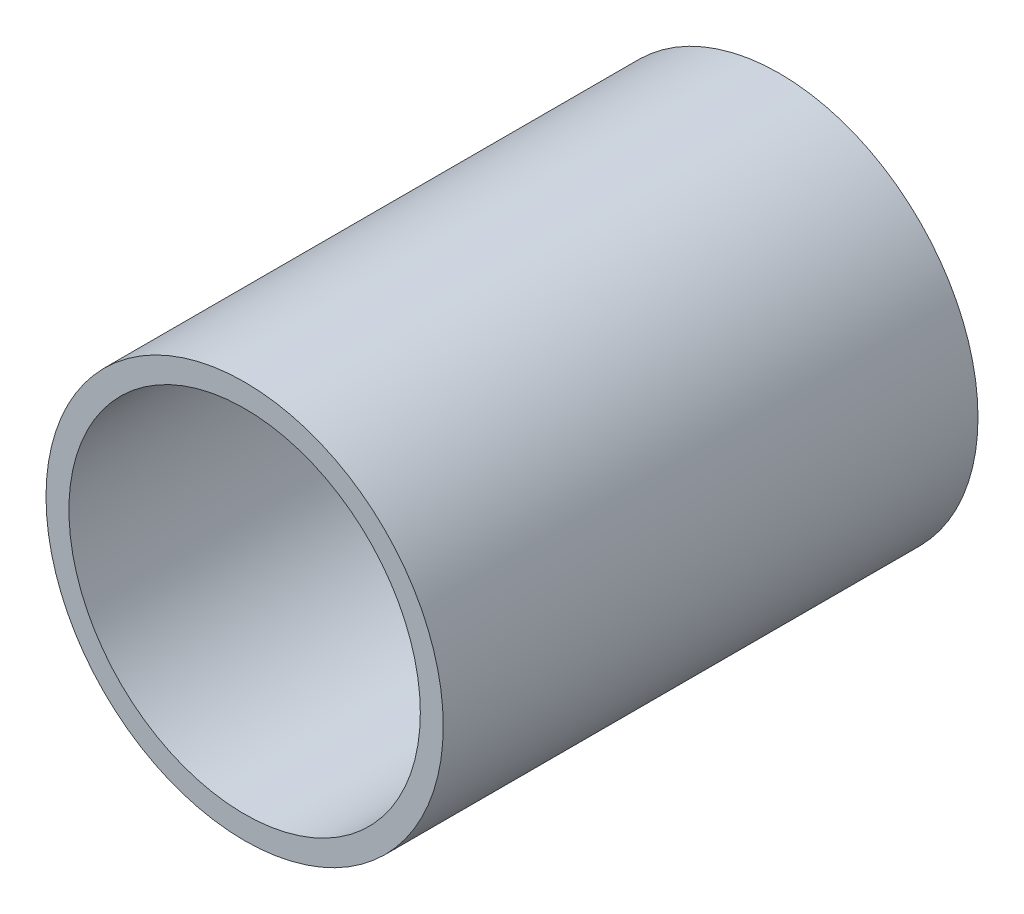
from build123d import *

# Parameters (mm, degrees)
SKETCH1_R           = 26
BOSS_EXTRUDE1_DEPTH = 70
CUT_EXTRUDE1_REACH  = 81.07
SKETCH2_R           = 23


with BuildPart() as part:
    # Sketch1 → Boss-Extrude1 (new body)
    with BuildSketch(Plane.XY):
        Circle(SKETCH1_R)
    extrude(amount=BOSS_EXTRUDE1_DEPTH)

    # Sketch2 → Cut-Extrude1 (cut, up to next)
    with BuildSketch(Plane.XY.offset(70), mode=Mode.PRIVATE) as cut_extrude1_sk1:
        Circle(SKETCH2_R)
    cut_extrude1_tool1 = extrude(cut_extrude1_sk1.sketch, amount=-CUT_EXTRUDE1_REACH, mode=Mode.PRIVATE) & part.part
    add(cut_extrude1_tool1.solids().sort_by_distance((0, 0, 70))[0], mode=Mode.SUBTRACT)


solid = part.part
